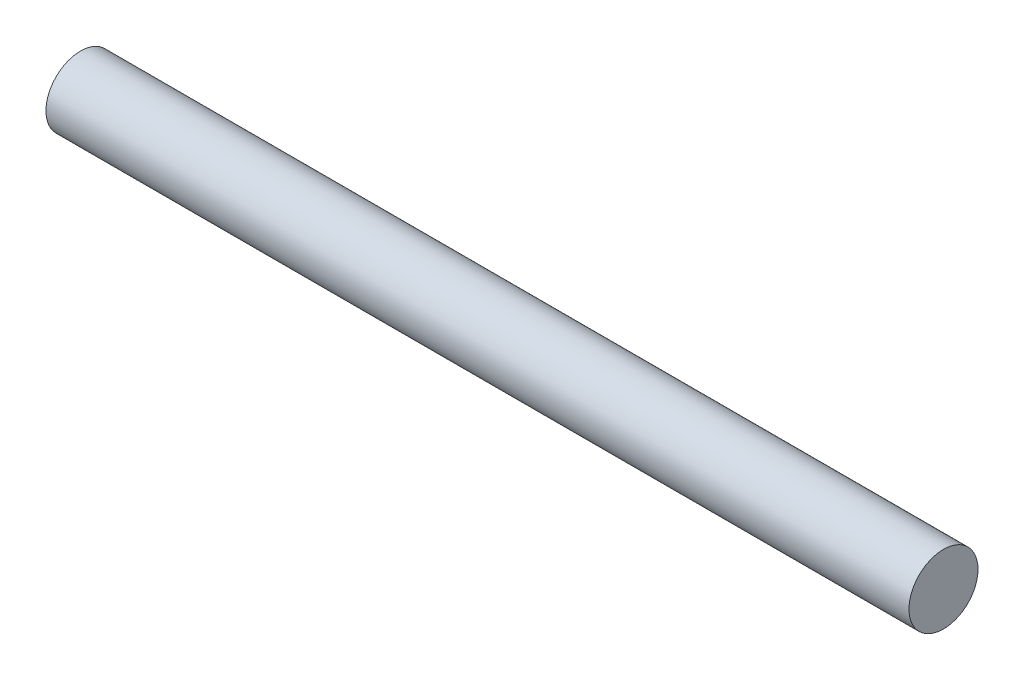
from build123d import *

# Parameters (mm, degrees)
SKETCH1_R           = 40
BOSS_EXTRUDE1_DEPTH = 1000


with BuildPart() as part:
    # Sketch1 → Boss-Extrude1 (new body)
    with BuildSketch(Plane(origin=(0, 0, 0), x_dir=(0, 0, -1), z_dir=(1, 0, 0))):
        Circle(SKETCH1_R)
    extrude(amount=BOSS_EXTRUDE1_DEPTH)


solid = part.part
